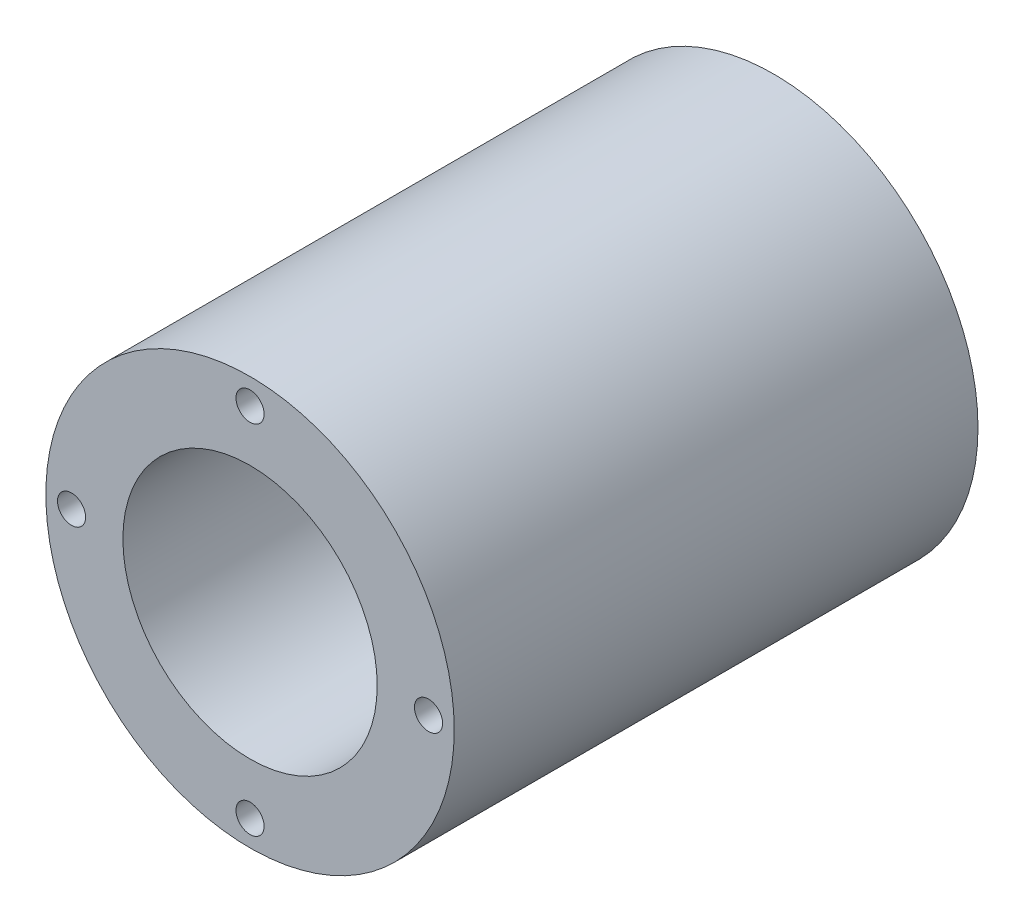
from build123d import *

# Parameters (mm, degrees)
SKETCH1_W              = 93.16400014
SKETCH1_H              = 13.7033
BACKFACEPATTERN_COUNT  = 6
FRONTFACEPATTERN_COUNT = 4
SKETCH7_R              = 26.9875
SKETCH7_R_2            = 24.60625
CUT_EXTRUDE1_DEPTH     = 0.5


with BuildPart() as part:
    # Sketch1 → Revolve1 (revolve)
    with BuildSketch(Plane(origin=(0, 0, 0), x_dir=(0, 0, -1), z_dir=(1, 0, 0)), mode=Mode.PRIVATE) as revolve1_sk:
        with Locations((-72.887000006, 29.47035)):
            Rectangle(SKETCH1_W, SKETCH1_H)
    revolve(revolve1_sk.sketch.rotate(Axis((0, 0, 119.469000076), (0, 0, -1)), 90), axis=Axis((0, 0, 119.469000076), (0, 0, -1)))

    # Sketch9 → M6x1.0 Tapped Hole3 (revolve, cut)
    with BuildSketch(Plane(origin=(0, 30.470350032, 26.304999936), x_dir=(0, 1, 0), z_dir=(1, 0, 0))):
        Polygon((0, 0), (0, 16.488151548), (2.5, 14.986), (2.5, 0), align=None)
    m6x1_0_tapped_hole3 = revolve(axis=Axis((0, 30.470350032, 19.954999936), (0, 0, 1)), mode=Mode.SUBTRACT)

    # BackFacePattern: M6x1.0 Tapped Hole3 ×6 about axis
    backfacepattern_axis = Axis((0, 0, 0), (0, 0, 1))
    for i in range(1, BACKFACEPATTERN_COUNT):
        add(m6x1_0_tapped_hole3.rotate(backfacepattern_axis, i * 360 / BACKFACEPATTERN_COUNT), mode=Mode.SUBTRACT)

    # Sketch6 → M6x1.0 Tapped Hole2 (revolve, cut)
    with BuildSketch(Plane(origin=(0, 31.75, 119.469000076), x_dir=(0, -1, 0), z_dir=(1, 0, 0))):
        Polygon((0, 0), (0, 16.502151548), (2.5, 15), (2.5, 0), align=None)
    m6x1_0_tapped_hole2 = revolve(axis=Axis((0, 31.75, 125.819000076), (0, 0, -1)), mode=Mode.SUBTRACT)

    # FrontFacePattern: M6x1.0 Tapped Hole2 ×4 about axis
    frontfacepattern_axis = Axis((0, 0, 0), (0, 0, 1))
    for i in range(1, FRONTFACEPATTERN_COUNT):
        add(m6x1_0_tapped_hole2.rotate(frontfacepattern_axis, i * 360 / FRONTFACEPATTERN_COUNT), mode=Mode.SUBTRACT)

    # Sketch7 → Cut-Extrude1 (cut)
    with BuildSketch(Plane(origin=(0, 0, 26.304999936), x_dir=(-1, 0, 0), z_dir=(0, 0, -1))):
        with Locations(Location((0, 0, 0), (0, 0, 90))):
            Circle(SKETCH7_R)
        with Locations(Location((0, 0, 0), (0, 0, 90))):
            Circle(SKETCH7_R_2, mode=Mode.SUBTRACT)
    extrude(amount=-CUT_EXTRUDE1_DEPTH, mode=Mode.SUBTRACT)


solid = part.part
